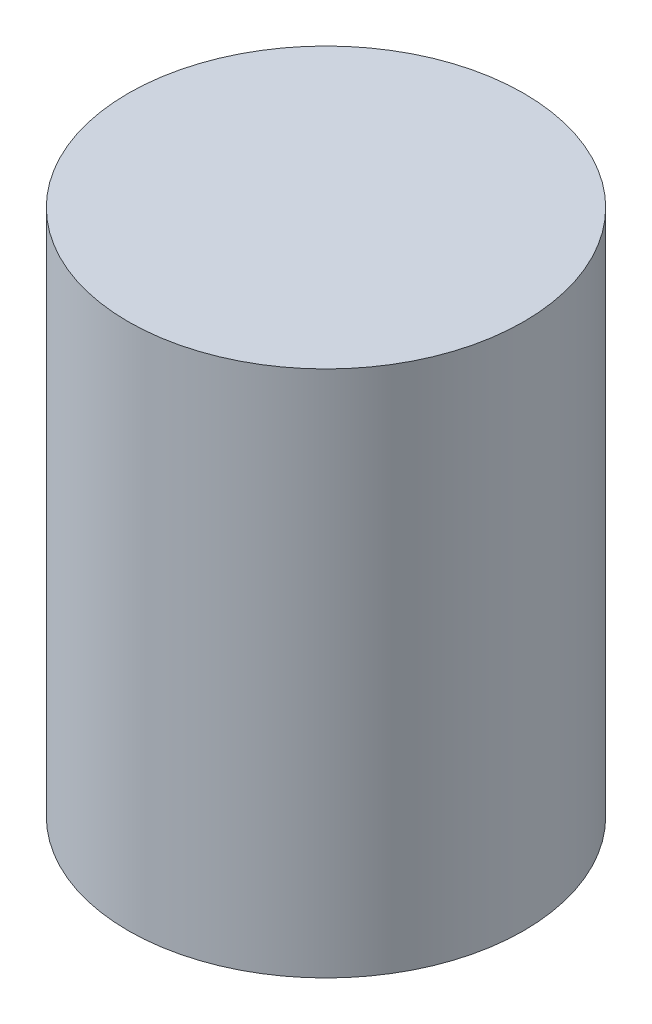
from build123d import *

# Parameters (mm, degrees)
SKETCH1_R           = 90
BOSS_EXTRUDE1_DEPTH = 240
SHELL1_T            = 12


with BuildPart() as part:
    # Sketch1 → Boss-Extrude1 (new body)
    with BuildSketch(Plane(origin=(0, 0, 0), x_dir=(1, 0, 0), z_dir=(0, 1, 0))):
        with Locations(Location((0, 0, 0), (0, 0, 270))):
            Circle(SKETCH1_R)
    extrude(amount=BOSS_EXTRUDE1_DEPTH)

    # Shell1 (no face opened: a closed hollow body)
    add(offset(amount=-SHELL1_T, mode=Mode.PRIVATE), mode=Mode.SUBTRACT)


solid = part.part
